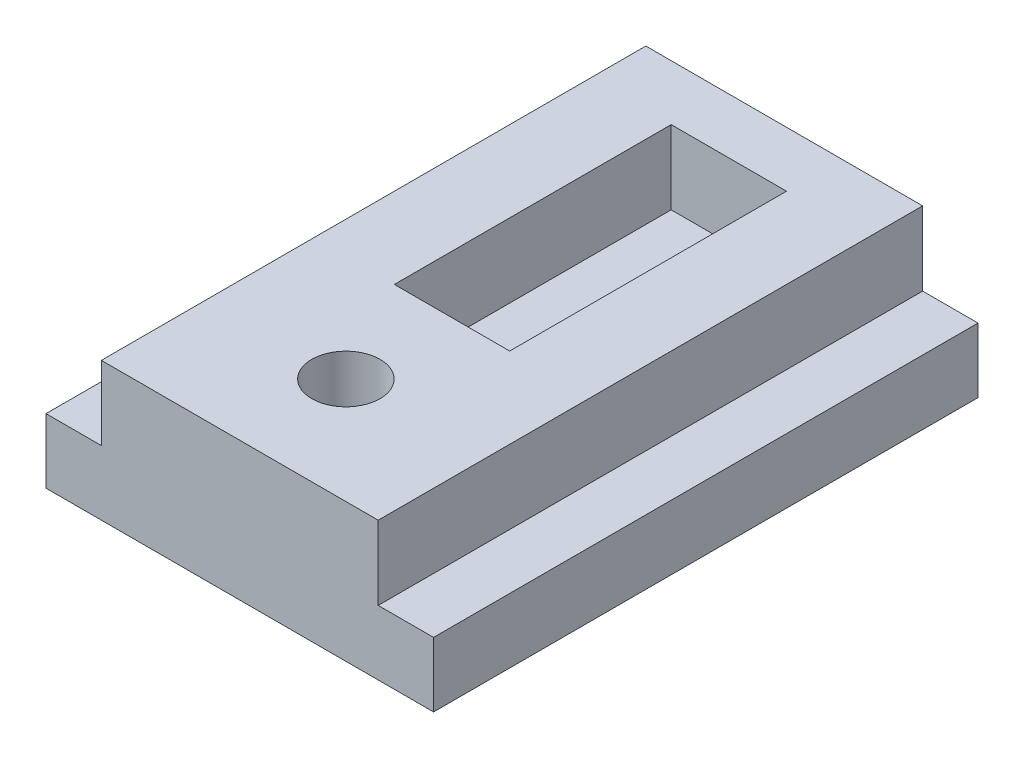
from build123d import *

# Parameters (mm, degrees)
BOSS_EXTRUDE1_DEPTH        = 14.75
SKETCH3_W                  = 6.25
SKETCH3_H                  = 4
CUT_EXTRUDE1_DEPTH         = 15
F_3_7_3_7_DIAMETER_HOLE1_D = 3.7


with BuildPart() as part:
    # Sketch1 → Boss-Extrude1 (new, symmetric)
    with BuildSketch(Plane.XY):
        Polygon((-7.5, -0.25), (-7.5, 3.75), (7.5, 3.75), (7.5, -0.25), (10.5, -0.25), (10.5, -3.75), (-10.5, -3.75), (-10.5, -0.25), align=None)
    extrude(amount=BOSS_EXTRUDE1_DEPTH, both=True)

    # Sketch3 → Cut-Extrude1 (cut)
    with BuildSketch(Plane(origin=(0, 0, -11.75), x_dir=(-1, 0, 0), z_dir=(0, 0, -1))):
        with Locations((0, 1.75)):
            Rectangle(SKETCH3_W, SKETCH3_H)
    extrude(amount=-CUT_EXTRUDE1_DEPTH, mode=Mode.SUBTRACT)

    # Ø3.7 (3.7) Diameter Hole1 (through all)
    with Locations(Plane(origin=(0, 3.75, 0), x_dir=(1, 0, 0), z_dir=(0, 1, 0))):
        with Locations((0, -9)):
            Hole(F_3_7_3_7_DIAMETER_HOLE1_D / 2)


solid = part.part
